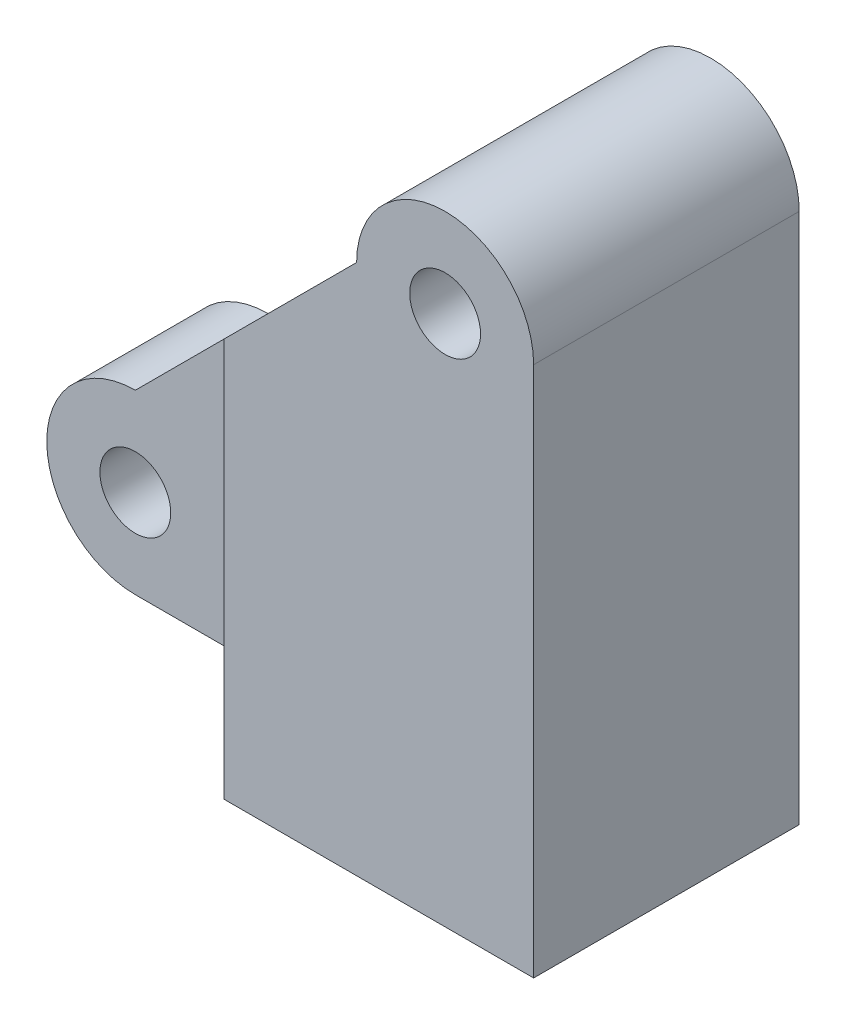
from build123d import *

# Parameters (mm, degrees)
SKETCH1_R           = 4
BOSS_EXTRUDE1_DEPTH = 30
CUT_EXTRUDE3_START  = -15
CUT_EXTRUDE3_DEPTH  = 15


with BuildPart() as part:
    # Sketch1 → Boss-Extrude1 (new body)
    with BuildSketch(Plane.XY):
        with BuildLine():
            Line((0, -10), (60, -10))
            Line((60, -10), (60, 50))
            ThreePointArc((60, 50), (50, 60), (40, 50))
            Line((40, 50), (0, 10))
            ThreePointArc((0, 10), (-10, 0), (0, -10))
        make_face()
        with Locations((50, 50)):
            Circle(SKETCH1_R, mode=Mode.SUBTRACT)
        Circle(SKETCH1_R, mode=Mode.SUBTRACT)
    extrude(amount=BOSS_EXTRUDE1_DEPTH)

    # Sketch3 → Cut-Extrude3 (cut)
    with BuildSketch(Plane.XY.offset(30).offset(CUT_EXTRUDE3_START)):
        with BuildLine():
            Line((60, -217.989898732), (60, -10))
            Line((60, -10), (60, 50))
            ThreePointArc((60, 50), (50, 60), (40, 50))
            Line((40, 50), (0, 10))
            ThreePointArc((0, 10), (-10, 0), (0, -10))
            Line((0, -10), (60, -10))
            Line((60, -10), (25, -10))
            Line((25, -10), (25, 35))
            Line((25, 35), (25, 242.989898732))
            Line((25, 242.989898732), (-389.785969286, 211.497176047))
            Line((-389.785969286, 211.497176047), (-354.785969286, -249.482621417))
            Line((-354.785969286, -249.482621417), (60, -217.989898732))
        make_face()
    extrude(amount=CUT_EXTRUDE3_DEPTH, mode=Mode.SUBTRACT)


solid = part.part
